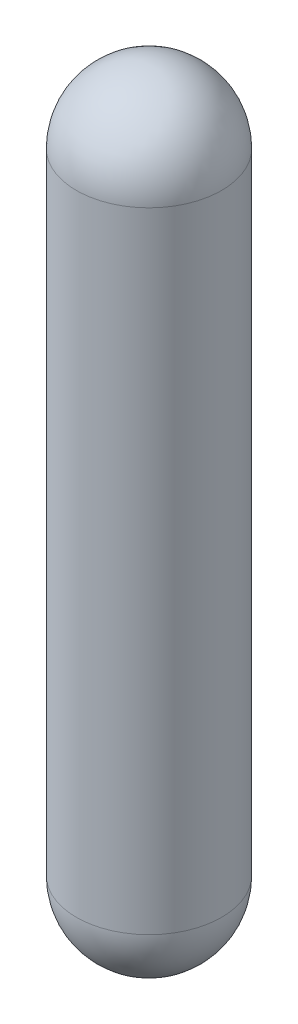
from build123d import *


with BuildPart() as part:
    # Esquisse1 → Révolution1 (revolve)
    with BuildSketch(Plane.XY):
        with BuildLine():
            Line((-3, 29), (-3, 3))
            ThreePointArc((-3, 3), (-2.121320344, 0.878679656), (0, 0))
            Line((0, 0), (0, 32))
            ThreePointArc((0, 32), (-2.121320344, 31.121320344), (-3, 29))
        make_face()
    revolve(axis=Axis((0, 0, 0), (0, 1, 0)))


solid = part.part
